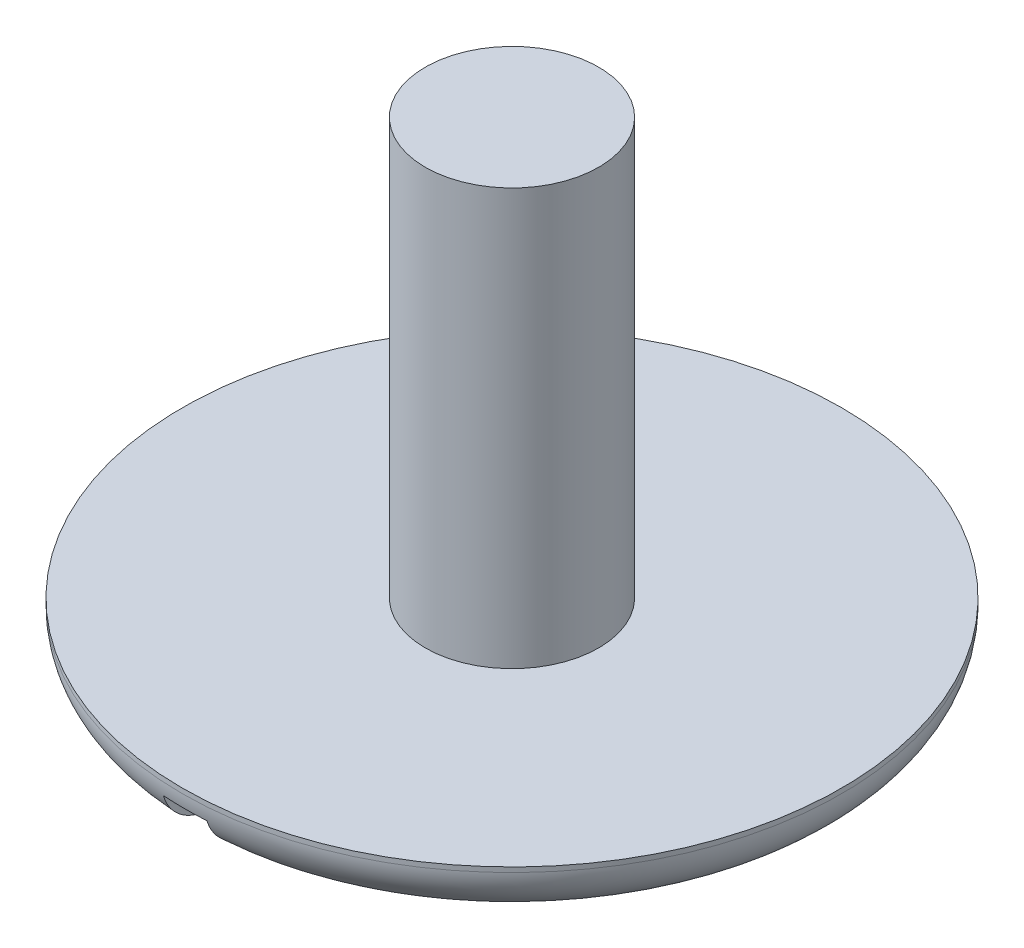
from build123d import *

# Parameters (mm, degrees)
SKETCH1_R           = 1.25
BOSS_EXTRUDE1_DEPTH = 6
SKETCH3_R           = 4.75
BOSS_EXTRUDE3_DEPTH = 0.77
FILLET1_R           = 0.7
SKETCH4_W           = 0.63
SKETCH4_H           = 9.781785326
CUT_EXTRUDE1_DEPTH  = 0.5


with BuildPart() as part:
    # Sketch1 → Boss-Extrude1 (new body)
    with BuildSketch(Plane(origin=(0, 0, 0), x_dir=(1, 0, 0), z_dir=(0, 1, 0))):
        Circle(SKETCH1_R)
    extrude(amount=BOSS_EXTRUDE1_DEPTH)

    # Sketch3 → Boss-Extrude3 (add)
    with BuildSketch(Plane.XZ):
        Circle(SKETCH3_R)
    extrude(amount=BOSS_EXTRUDE3_DEPTH)

    # Fillet1
    fillet1_edges = [part.edges().sort_by_distance(p)[0] for p in [
        (-4.75, -0.77, 0),
    ]]
    fillet(fillet1_edges, radius=FILLET1_R)

    # Sketch4 → Cut-Extrude1 (cut)
    with BuildSketch(Plane.XZ.offset(0.77)):
        Rectangle(SKETCH4_W, SKETCH4_H)
    extrude(amount=-CUT_EXTRUDE1_DEPTH, mode=Mode.SUBTRACT)


solid = part.part
